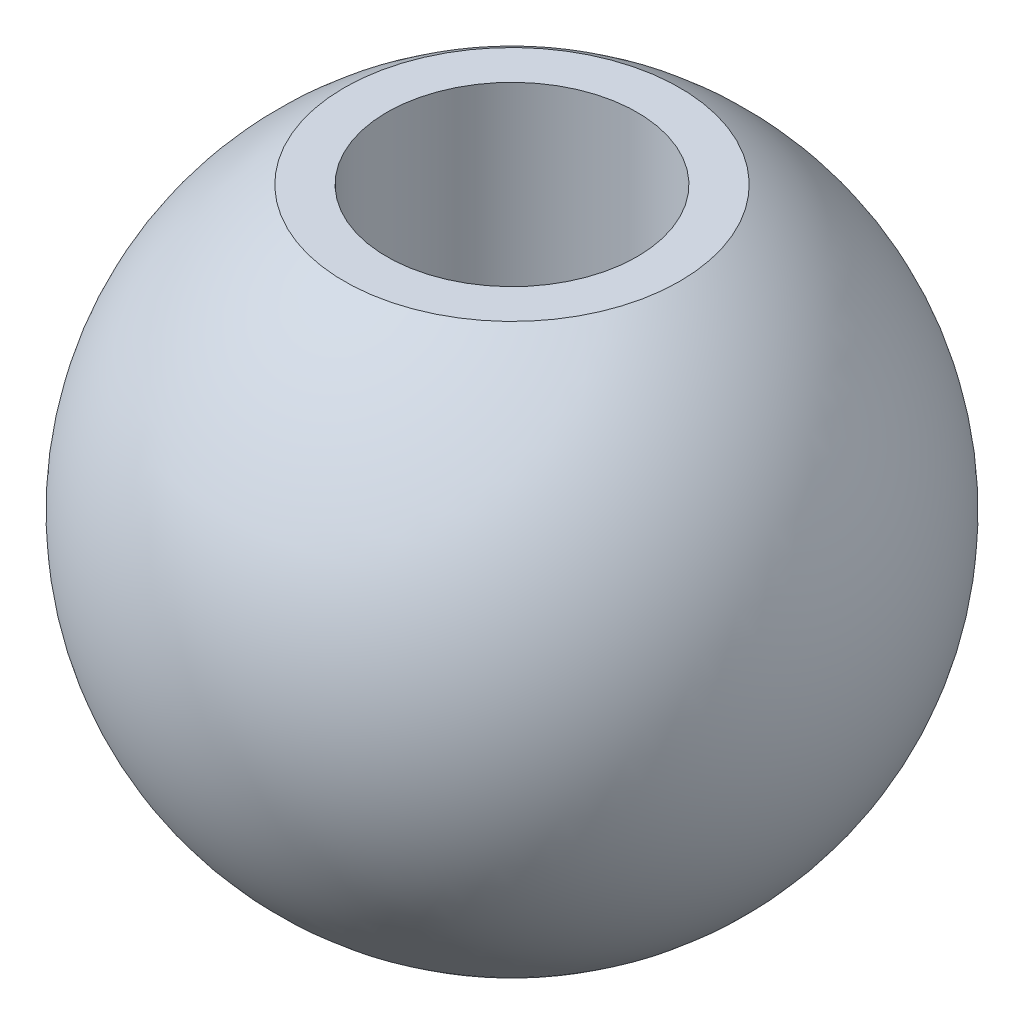
from build123d import *


with BuildPart() as part:
    # Sketch1 → Revolve1 (revolve)
    with BuildSketch(Plane.XY):
        with BuildLine():
            Line((2.010596926, 3.4), (1.5, 3.4))
            Line((1.5, 3.4), (1.5, -3.4))
            Line((1.5, -3.4), (2.010596926, -3.4))
            ThreePointArc((2.010596926, -3.4), (3.95, 0), (2.010596926, 3.4))
        make_face()
    revolve(axis=Axis((0, 3.4, 0), (0, -1, 0)))


solid = part.part
